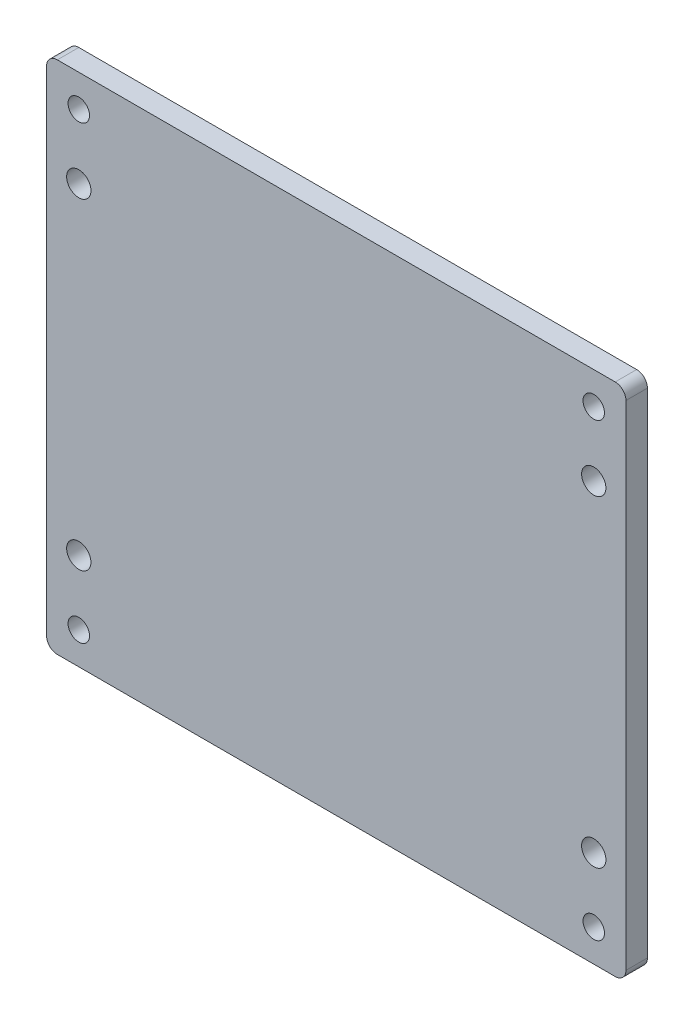
from build123d import *

# Parameters (mm, degrees)
MODEL_R                 = 1.5
MODEL_R_2               = 1.7
SALIENTE_EXTRUIR1_DEPTH = 3


with BuildPart() as part:
    # Model → Saliente-Extruir1 (new body)
    with BuildSketch(Plane.XY):
        with BuildLine():
            Line((85.482701858, 227.246277544), (7.478092, 227.246277544))
            ThreePointArc((7.478092, 227.246277544), (6.417431828, 227.685617372), (5.978092, 228.746277544))
            Line((5.978092, 228.746277544), (5.978092, 297.748681778))
            ThreePointArc((5.978092, 297.748681778), (6.417431828, 298.80934195), (7.478092, 299.248681778))
            Line((7.478092, 299.248681778), (85.482701858, 299.248681778))
            ThreePointArc((85.482701858, 299.248681778), (86.54336203, 298.80934195), (86.982701858, 297.748681778))
            Line((86.982701858, 297.748681778), (86.982701858, 228.746277544))
            ThreePointArc((86.982701858, 228.746277544), (86.54336203, 227.685617372), (85.482701858, 227.246277544))
        make_face()
        with Locations((82.48303636, 294.748681778)):
            Circle(MODEL_R, mode=Mode.SUBTRACT)
        with Locations((10.478092, 231.745943042)):
            Circle(MODEL_R, mode=Mode.SUBTRACT)
        with Locations((82.48303636, 231.745943042)):
            Circle(MODEL_R, mode=Mode.SUBTRACT)
        with Locations((10.478092, 294.748681778)):
            Circle(MODEL_R, mode=Mode.SUBTRACT)
        with Locations((10.478092, 240.74560854)):
            Circle(MODEL_R_2, mode=Mode.SUBTRACT)
        with Locations((10.478092, 285.74901628)):
            Circle(MODEL_R_2, mode=Mode.SUBTRACT)
        with Locations((82.48303636, 240.74560854)):
            Circle(MODEL_R_2, mode=Mode.SUBTRACT)
        with Locations((82.48303636, 285.74901628)):
            Circle(MODEL_R_2, mode=Mode.SUBTRACT)
    extrude(amount=SALIENTE_EXTRUIR1_DEPTH)


solid = part.part
